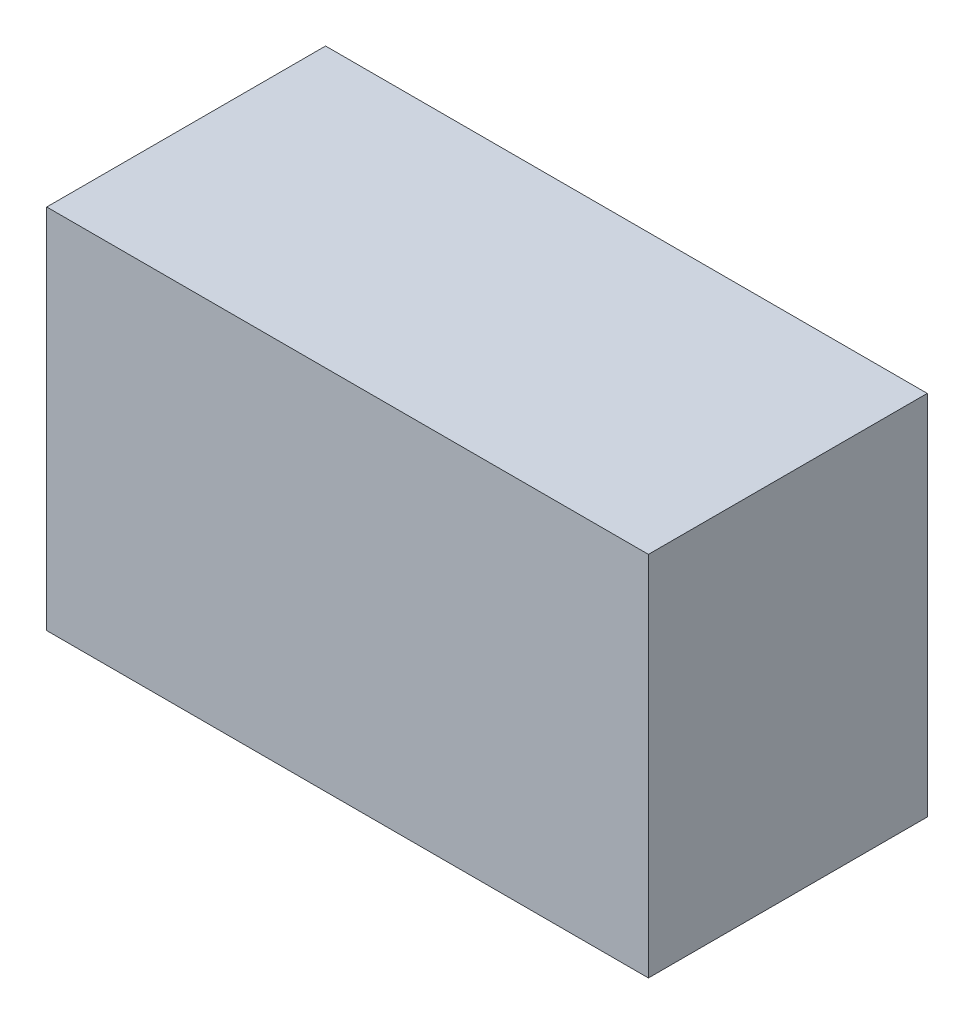
from build123d import *

# Parameters (mm, degrees)
SKETCH_2_W      = 41
SKETCH_2_H      = 25
EXTRUDE_1_DEPTH = 19


with BuildPart() as part:
    # 草图2 → 凸台-拉伸1 (new body)
    with BuildSketch(Plane.XY):
        Rectangle(SKETCH_2_W, SKETCH_2_H)
    extrude(amount=EXTRUDE_1_DEPTH)


solid = part.part
